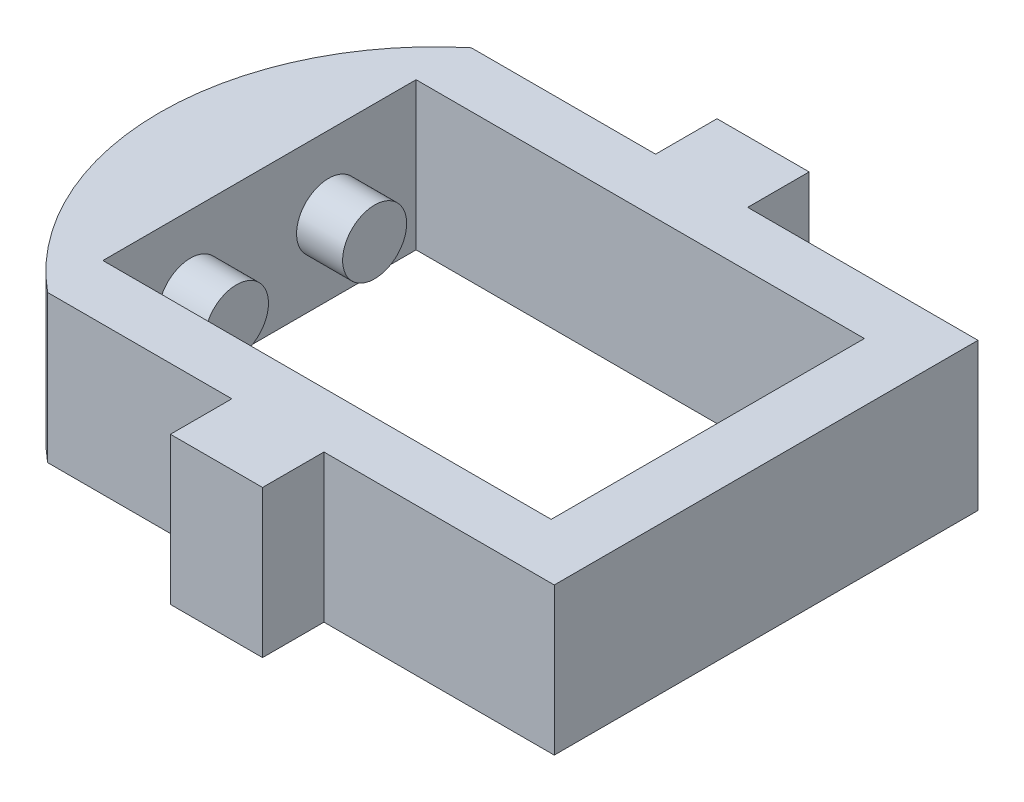
from build123d import *

# Parameters (mm, degrees)
SKETCH1_W           = 29.2
SKETCH1_H           = 20.4
BOSS_EXTRUDE1_DEPTH = 9.6
SKETCH3_R           = 2.085
BOSS_EXTRUDE3_DEPTH = 3


with BuildPart() as part:
    # Sketch1 → Boss-Extrude1 (new body)
    with BuildSketch(Plane(origin=(0, 0, 0), x_dir=(1, 0, 0), z_dir=(0, 1, 0))):
        with BuildLine():
            Line((-6, 13.8), (-18, 13.8))
            ThreePointArc((-18, 13.8), (-24.5, 0), (-18, -13.8))
            Line((-18, -13.8), (-6, -13.8))
            Line((-6, -13.8), (-6, -17.8))
            Line((-6, -17.8), (0, -17.8))
            Line((0, -17.8), (0, -13.8))
            Line((0, -13.8), (15, -13.8))
            Line((15, -13.8), (15, 13.8))
            Line((15, 13.8), (0, 13.8))
            Line((0, 13.8), (0, 17.8))
            Line((0, 17.8), (-6, 17.8))
            Line((-6, 17.8), (-6, 13.8))
        make_face()
        with Locations((-3.4, 0)):
            Rectangle(SKETCH1_W, SKETCH1_H, mode=Mode.SUBTRACT)
    extrude(amount=BOSS_EXTRUDE1_DEPTH)

    # Sketch3 → Boss-Extrude3 (add)
    with BuildSketch(Plane(origin=(-18, 0, 0), x_dir=(0, 0, -1), z_dir=(1, 0, 0))):
        with Locations((-4.5, 4.8)):
            Circle(SKETCH3_R)
        with Locations((4.5, 4.8)):
            Circle(SKETCH3_R)
    extrude(amount=BOSS_EXTRUDE3_DEPTH)


solid = part.part
